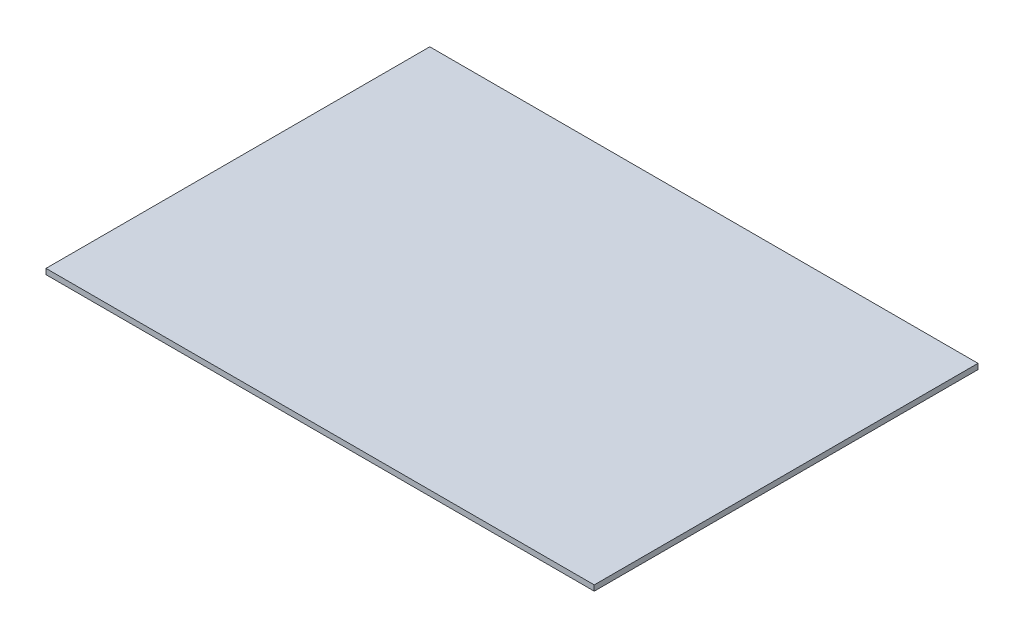
from build123d import *

# Parameters (mm, degrees)
SKETCH1_W           = 300
SKETCH1_H           = 210
BOSS_EXTRUDE1_DEPTH = 3


with BuildPart() as part:
    # Sketch1 → Boss-Extrude1 (new body)
    with BuildSketch(Plane(origin=(0, 0, 0), x_dir=(1, 0, 0), z_dir=(0, 1, 0))):
        with Locations((62.483745124, -19.759427828)):
            Rectangle(SKETCH1_W, SKETCH1_H)
    extrude(amount=BOSS_EXTRUDE1_DEPTH)


solid = part.part
